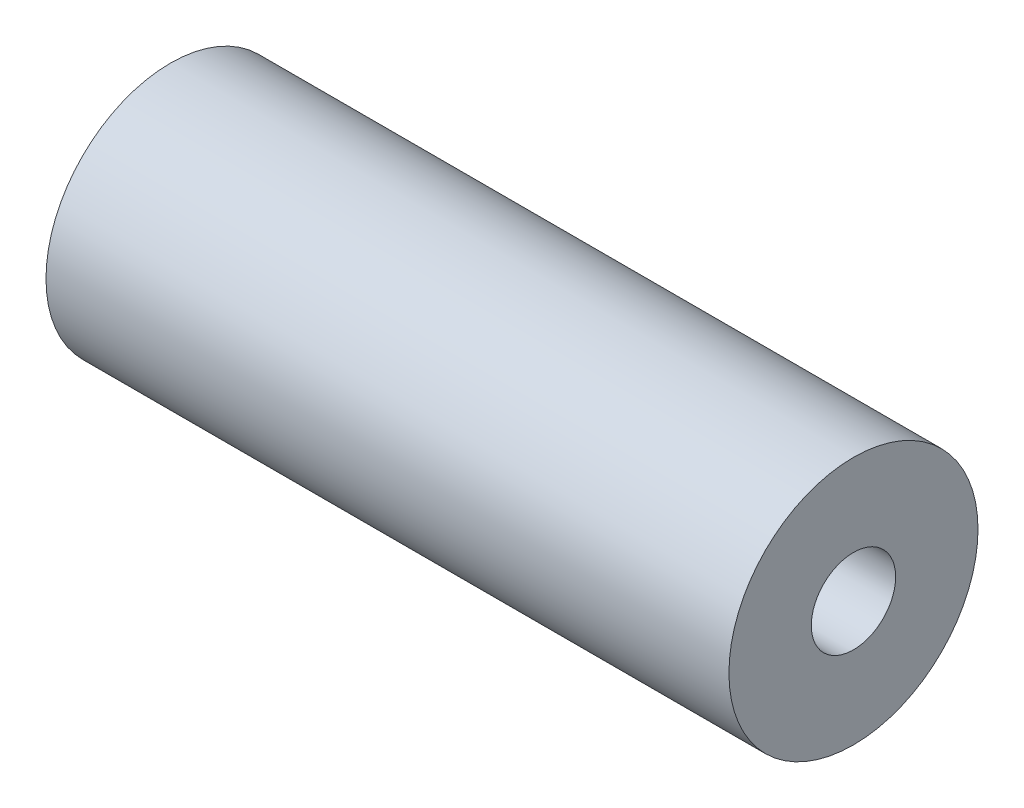
from build123d import *

# Parameters (mm, degrees)
SKETCH_2_R              = 31
EXTRUDE_1_DEPTH         = 170
HOLE_WIZARD_M24_1_D     = 21
HOLE_WIZARD_M24_1_DEPTH = 40
HOLE_WIZARD_M24_1_TIP   = 6.3090365
CUT_EXTRUDE_START       = -40
SKETCH_6_R              = 15
CUT_EXTRUDE_1_DEPTH     = 54
CUT_EXTRUDE_START_2     = -25
CUT_EXTRUDE_2_DEPTH     = 151.561954876


with BuildPart() as part:
    # 草图2 → 凸台-拉伸1 (new body)
    with BuildSketch(Plane(origin=(0, 0, 0), x_dir=(0, 0, -1), z_dir=(1, 0, 0))):
        Circle(SKETCH_2_R)
    extrude(amount=EXTRUDE_1_DEPTH)

    # M24 螺纹孔1
    with Locations(Plane(origin=(170, 0, 0), x_dir=(0, 0, -1), z_dir=(1, 0, 0))):
        with Locations((0, 0)):
            Hole(HOLE_WIZARD_M24_1_D / 2, depth=HOLE_WIZARD_M24_1_DEPTH)
            with Locations((0, 0, -(HOLE_WIZARD_M24_1_DEPTH + HOLE_WIZARD_M24_1_TIP / 2))):  # 118° drill point
                Cone(0, HOLE_WIZARD_M24_1_D / 2, HOLE_WIZARD_M24_1_TIP, mode=Mode.SUBTRACT)

    # 草图6 → 切除-拉伸1 (cut)
    with BuildSketch(Plane(origin=(170, 0, 0), x_dir=(0, 0, -1), z_dir=(1, 0, 0)).offset(CUT_EXTRUDE_START)):
        Circle(SKETCH_6_R)
    extrude(amount=-CUT_EXTRUDE_1_DEPTH, mode=Mode.SUBTRACT)

    # 草图7 → 切除-旋转1 (revolve, cut)
    with BuildSketch(Plane.XY, mode=Mode.PRIVATE) as cut_revolve_1_sk:
        Polygon((0, 0), (76, 0), (76, 10), (0, 13.8), align=None)
    revolve(cut_revolve_1_sk.sketch.rotate(Axis((76, 0, 0), (1, 0, 0)), 270), axis=Axis((76, 0, 0), (1, 0, 0)), mode=Mode.SUBTRACT)

    # 草图8 → 切除-拉伸2 (cut, through all)
    with BuildSketch(Plane(origin=(0, 0, 0), x_dir=(1, 0, 0), z_dir=(0, 1, 0)).offset(CUT_EXTRUDE_START_2)):
        with BuildLine():
            Line((25, 5), (83, 5))
            ThreePointArc((83, 5), (88, 0), (83, -5))
            Line((83, -5), (25, -5))
            ThreePointArc((25, -5), (20, 0), (25, 5))
        make_face()
    extrude(amount=-CUT_EXTRUDE_2_DEPTH, mode=Mode.SUBTRACT)


solid = part.part
